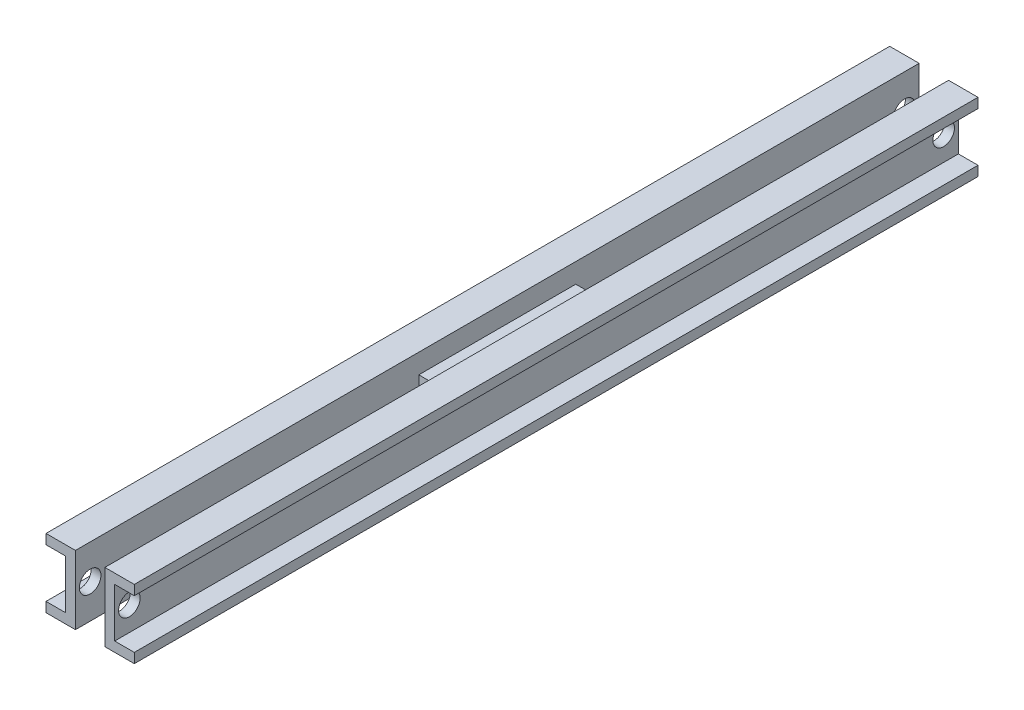
from build123d import *

# Parameters (mm, degrees)
BOSS_EXTRUDE1_DEPTH = 80
BOSS_EXTRUDE2_DEPTH = 350
BOSS_EXTRUDE3_DEPTH = 350
SKETCH4_R           = 11
CUT_EXTRUDE1_DEPTH  = 350


with BuildPart() as part:
    # Sketch1 → Boss-Extrude1 (new, symmetric)
    with BuildSketch(Plane.XY):
        Polygon((15, 15), (-15, 15), (-15, 35), (-45, 35), (-45, 25), (-25, 25), (-25, -25), (-45, -25), (-45, -35), (-15, -35), (-15, -15), (15, -15), (15, -35), (45, -35), (45, -25), (25, -25), (25, 25), (45, 25), (45, 35), (15, 35), align=None)
    extrude(amount=BOSS_EXTRUDE1_DEPTH, both=True)

    # Sketch2 → Boss-Extrude2 (add)
    with BuildSketch(Plane.XY.offset(80)):
        Polygon((-45, -25), (-45, -35), (-15, -35), (-15, 35), (-45, 35), (-45, 25), (-25, 25), (-25, -25), align=None)
        Polygon((15, 35), (45, 35), (45, 25), (25, 25), (25, -25), (45, -25), (45, -35), (15, -35), align=None)
    extrude(amount=BOSS_EXTRUDE2_DEPTH)

    # Sketch3 → Boss-Extrude3 (add)
    with BuildSketch(Plane(origin=(0, 0, -80), x_dir=(-1, 0, 0), z_dir=(0, 0, -1))):
        Polygon((-45, -25), (-45, -35), (-15, -35), (-15, 35), (-45, 35), (-45, 25), (-25, 25), (-25, -25), align=None)
        Polygon((45, 35), (15, 35), (15, -35), (45, -35), (45, -25), (25, -25), (25, 25), (45, 25), align=None)
    extrude(amount=BOSS_EXTRUDE3_DEPTH)

    # Sketch4 → Cut-Extrude1 (cut)
    with BuildSketch(Plane.ZY.offset(25)):
        with Locations(Location((-415, 0, 0), (0, 0, 270))):
            Circle(SKETCH4_R)
        with Locations(Location((415, 0, 0), (0, 0, 270))):
            Circle(SKETCH4_R)
    extrude(amount=-CUT_EXTRUDE1_DEPTH, mode=Mode.SUBTRACT)


solid = part.part
